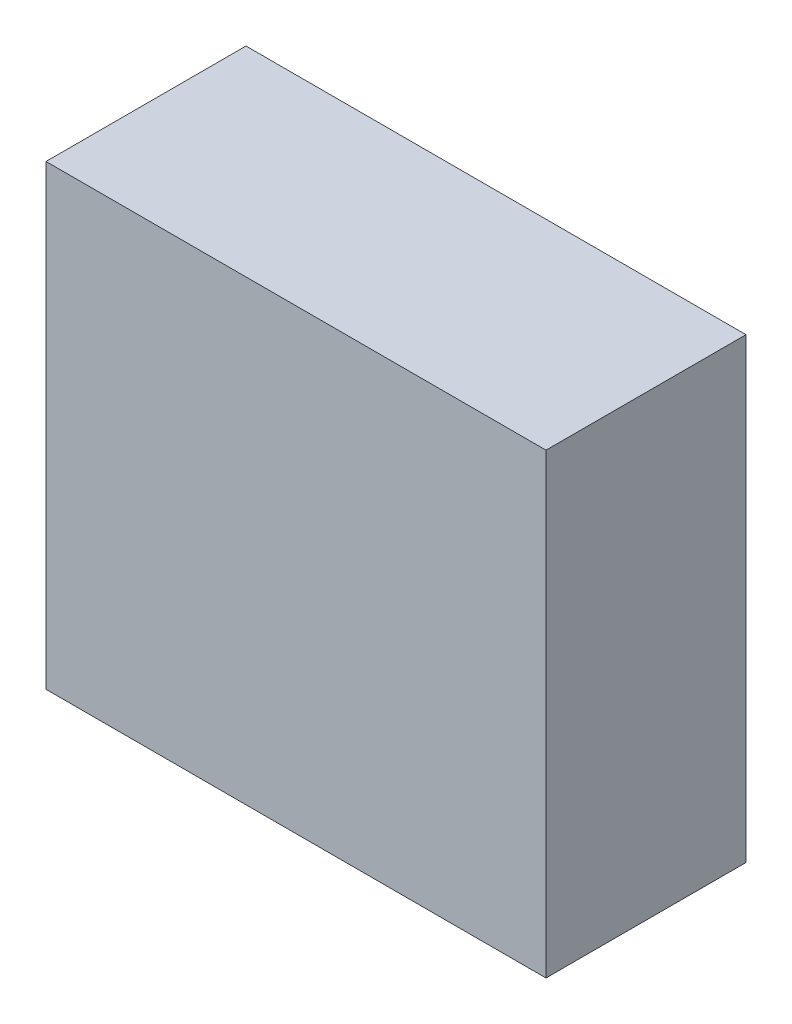
from build123d import *

# Parameters (mm, degrees)
SKETCH_1_W              = 3.5
SKETCH_1_H              = 3.2
COMPONENT_OUTLINE_DEPTH = 1.4


with BuildPart() as part:
    # 草图1 → Component_Outline (new body)
    with BuildSketch(Plane.XY):
        Rectangle(SKETCH_1_W, SKETCH_1_H)
    extrude(amount=COMPONENT_OUTLINE_DEPTH)


solid = part.part
